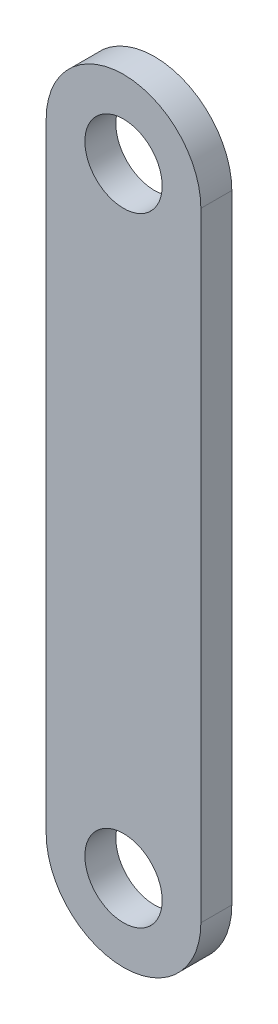
from build123d import *

# Parameters (mm, degrees)
SKETCH_2_R      = 2.5
EXTRUDE_1_DEPTH = 2


with BuildPart() as part:
    # 草图2 → 凸台-拉伸1 (new body)
    with BuildSketch(Plane.XY):
        with BuildLine():
            Line((-5, 7.5), (-5, 47.5))
            ThreePointArc((-5, 47.5), (0, 52.5), (5, 47.5))
            Line((5, 47.5), (5, 7.5))
            ThreePointArc((5, 7.5), (0, 2.5), (-5, 7.5))
        make_face()
        with Locations((0, 7.5)):
            Circle(SKETCH_2_R, mode=Mode.SUBTRACT)
        with Locations((0, 47.5)):
            Circle(SKETCH_2_R, mode=Mode.SUBTRACT)
    extrude(amount=EXTRUDE_1_DEPTH)


solid = part.part
